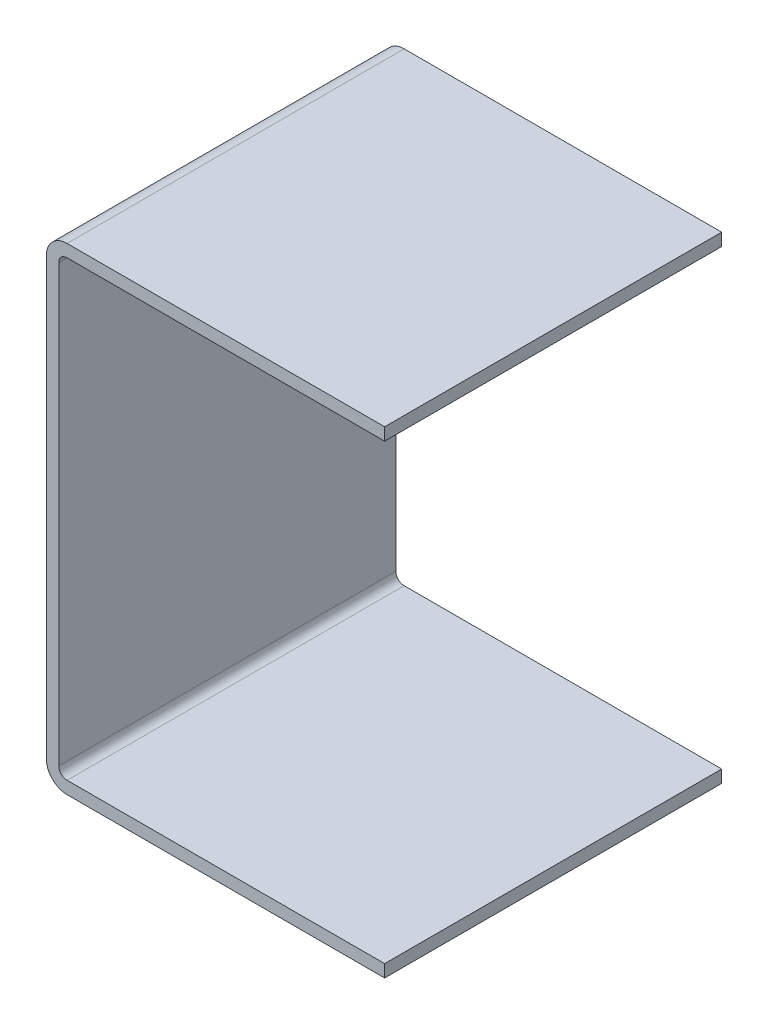
from build123d import *

# Parameters (mm, degrees)
EXTRUSION1_DEPTH = 40.6


with BuildPart() as part:
    # Esquisse1 → Extrusion1 (new, symmetric)
    with BuildSketch(Plane.XY):
        with BuildLine():
            Line((-47.575077806, -19.430156076), (-47.575077806, 85.569843924))
            ThreePointArc((-47.575077806, 85.569843924), (-46.110611712, 89.10537783), (-42.575077806, 90.569843924))
            Line((-42.575077806, 90.569843924), (33.924922194, 90.569843924))
            Line((33.924922194, 90.569843924), (33.924922194, 87.569843924))
            Line((33.924922194, 87.569843924), (-42.575077806, 87.569843924))
            ThreePointArc((-42.575077806, 87.569843924), (-43.989291368, 86.984057487), (-44.575077806, 85.569843924))
            Line((-44.575077806, 85.569843924), (-44.575077806, -19.430156076))
            ThreePointArc((-44.575077806, -19.430156076), (-43.989291368, -20.844369638), (-42.575077806, -21.430156076))
            Line((-42.575077806, -21.430156076), (33.924922194, -21.430156076))
            Line((33.924922194, -21.430156076), (33.924922194, -24.430156076))
            Line((33.924922194, -24.430156076), (-42.575077806, -24.430156076))
            ThreePointArc((-42.575077806, -24.430156076), (-46.110611712, -22.965689982), (-47.575077806, -19.430156076))
        make_face()
    extrude(amount=EXTRUSION1_DEPTH, both=True)


solid = part.part
